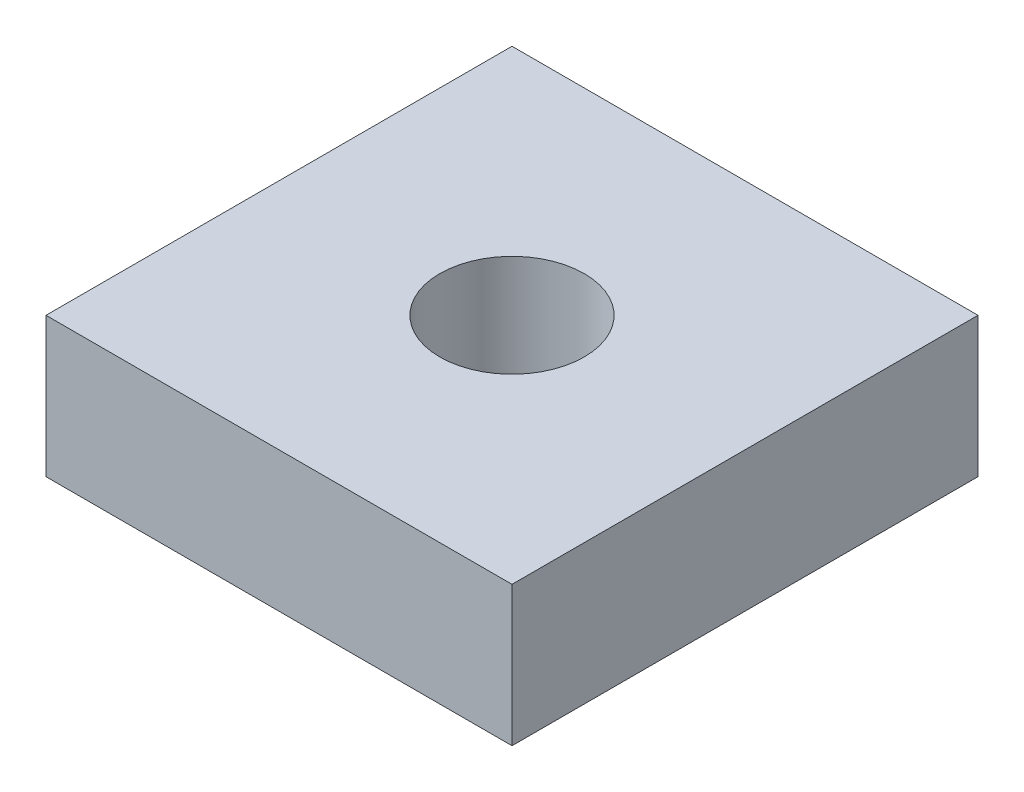
from build123d import *

# Parameters (mm, degrees)
CROQUIS1_W              = 10
CROQUIS1_H              = 10
CROQUIS1_R              = 1.55
SALIENTE_EXTRUIR1_DEPTH = 3


with BuildPart() as part:
    # Croquis1 → Saliente-Extruir1 (new body)
    with BuildSketch(Plane(origin=(0, 0, 0), x_dir=(1, 0, 0), z_dir=(0, 1, 0))):
        Rectangle(CROQUIS1_W, CROQUIS1_H)
        with Locations(Location((0, 0, 0), (0, 0, 270))):
            Circle(CROQUIS1_R, mode=Mode.SUBTRACT)
    extrude(amount=SALIENTE_EXTRUIR1_DEPTH)


solid = part.part
